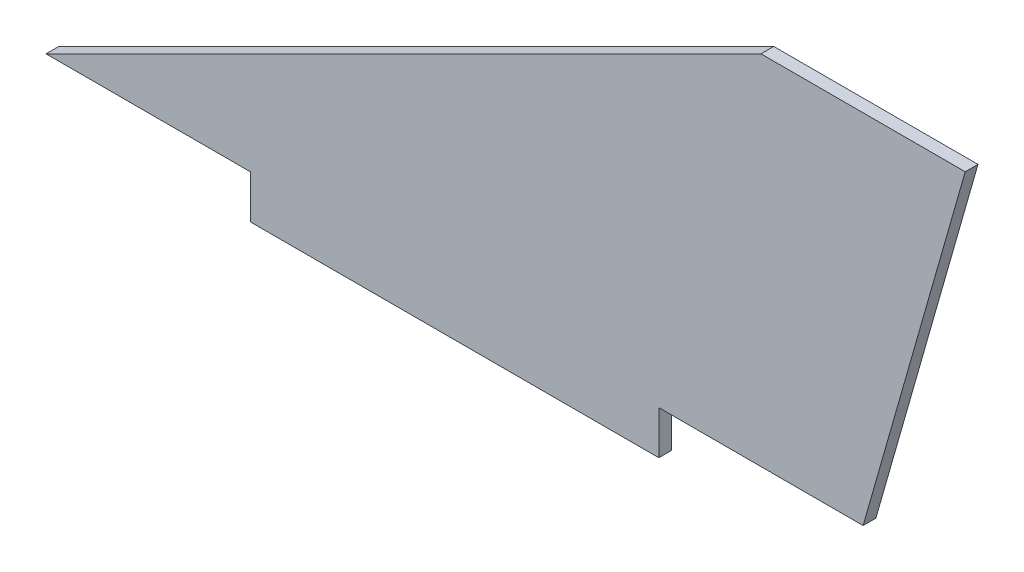
from build123d import *

# Parameters (mm, degrees)
BOSS_EXTRUDE1_DEPTH = 3.175


with BuildPart() as part:
    # Sketch1 → Boss-Extrude1 (new body)
    with BuildSketch(Plane.XY):
        Polygon((0, 0), (50.8, 0), (50.8, -10.795), (152.4, -10.795), (152.4, 0), (203.2, 0), (228.6, 88.9), (177.8, 88.9), align=None)
    extrude(amount=BOSS_EXTRUDE1_DEPTH)


solid = part.part
